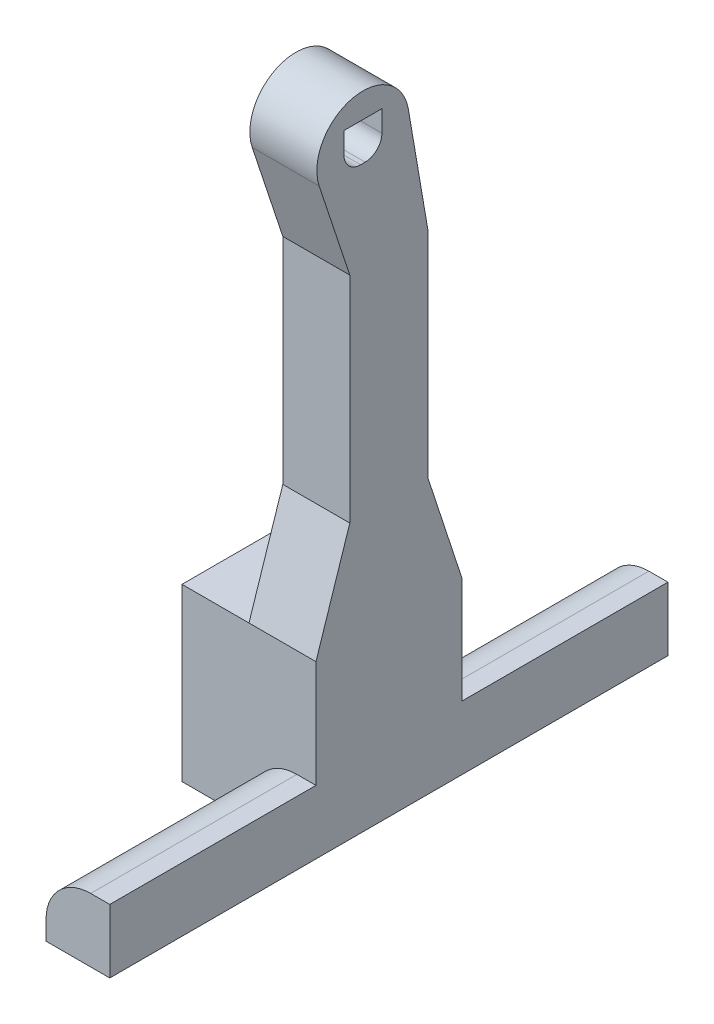
from build123d import *

# Parameters (mm, degrees)
SKETCH1_W                = 3.530112864
SKETCH1_H                = 9.82
BOSS_EXTRUDE2_DEPTH      = 6
SKETCH1_4_W              = 6
SKETCH1_4_H              = 9.82
SKETCH1_4_W_2            = 3.530112864
BOSS_EXTRUDE3_DEPTH      = 6
BOSS_EXTRUDE4_DEPTH      = 18.469887
BOSS_EXTRUDE4_DEPTH_BACK = 31.530113


with BuildPart() as part:
    # Sketch1 → Boss-Extrude2 (new body)
    with BuildSketch(Plane(origin=(0, 0, 0), x_dir=(0, 0, -1), z_dir=(1, 0, 0))):
        with Locations((4.765056432, 4.91)):
            Rectangle(SKETCH1_W, SKETCH1_H)
        with Locations((-4.765056432, 4.91)):
            Rectangle(SKETCH1_W, SKETCH1_H)
        Polygon((6.530112864, 9.82), (6.530112864, 15.3052734), (-6.530112864, 15.3052734), (-6.530112864, 9.82), (-3, 9.82), (3, 9.82), align=None)
    extrude(amount=-BOSS_EXTRUDE2_DEPTH)

    # Sketch1<4> → Boss-Extrude3 (add)
    # profile 1 of 6: a face of its own
    with BuildSketch(Plane(origin=(0, 0, 0), x_dir=(0, 0, -1), z_dir=(1, 0, 0))):
        with Locations((0, 4.91)):
            Rectangle(SKETCH1_4_W, SKETCH1_4_H)
    # profile 2 of 6: a face of its own
    with BuildSketch(Plane(origin=(0, 0, 0), x_dir=(0, 0, -1), z_dir=(1, 0, 0))):
        Polygon((-6.530112864, 9.82), (-3, 9.82), (3, 9.82), (6.530112864, 9.82), (6.530112864, 15.3052734), (-6.530112864, 15.3052734), align=None)
    # profile 3 of 6: a face of its own
    with BuildSketch(Plane(origin=(0, 0, 0), x_dir=(0, 0, -1), z_dir=(1, 0, 0))):
        with Locations((-4.765056432, 4.91)):
            Rectangle(SKETCH1_4_W_2, SKETCH1_4_H)
    # profile 4 of 6: a face of its own
    with BuildSketch(Plane(origin=(0, 0, 0), x_dir=(0, 0, -1), z_dir=(1, 0, 0))):
        with Locations((4.765056432, 4.91)):
            Rectangle(SKETCH1_4_W_2, SKETCH1_4_H)
    # profile 5 of 6: a face of its own
    with BuildSketch(Plane(origin=(0, 0, 0), x_dir=(0, 0, -1), z_dir=(1, 0, 0))):
        with BuildLine():
            Line((-3.498344074, 24.541666174), (-6.530112864, 15.3052734))
            Line((-6.530112864, 15.3052734), (6.530112864, 15.3052734))
            Line((6.530112864, 15.3052734), (3.498344074, 24.541666174))
            Line((3.498344074, 24.541666174), (3.498344074, 43.778718631))
            Line((3.498344074, 43.778718631), (1.742466173, 54.048264378))
            ThreePointArc((1.742466173, 54.048264378), (-3.323802498, 57.355930134), (-6.240866628, 52.055131338))
            Line((-6.240866628, 52.055131338), (-3.498344074, 43.778718631))
            Line((-3.498344074, 43.778718631), (-3.498344074, 24.541666174))
        make_face()
        with BuildLine():
            Line((-4.024402568, 55.252914737), (-0.624402568, 55.252914737))
            Line((-0.624402568, 55.252914737), (-0.624402568, 53.352914737))
            ThreePointArc((-0.624402568, 53.352914737), (-1.063742396, 52.292254566), (-2.124402568, 51.852914737))
            Line((-2.124402568, 51.852914737), (-2.524402568, 51.852914737))
            ThreePointArc((-2.524402568, 51.852914737), (-3.58506274, 52.292254566), (-4.024402568, 53.352914737))
            Line((-4.024402568, 53.352914737), (-4.024402568, 55.252914737))
        make_face(mode=Mode.SUBTRACT)
    # profile 6 of 6: a face of its own
    with BuildSketch(Plane(origin=(0, 0, 0), x_dir=(0, 0, -1), z_dir=(1, 0, 0))):
        with BuildLine():
            ThreePointArc((-3.824402568, 53.352914737), (-3.443641384, 52.433675922), (-2.524402568, 52.052914737))
            Line((-2.524402568, 52.052914737), (-2.124402568, 52.052914737))
            ThreePointArc((-2.124402568, 52.052914737), (-1.205163753, 52.433675922), (-0.824402568, 53.352914737))
            Line((-0.824402568, 53.352914737), (-0.824402568, 55.052914737))
            Line((-0.824402568, 55.052914737), (-3.824402568, 55.052914737))
            Line((-3.824402568, 55.052914737), (-3.824402568, 53.352914737))
        make_face()
    extrude(amount=BOSS_EXTRUDE3_DEPTH)


with BuildPart() as boss_extrude3_kept_piece:
    # of the separate pieces the step leaves, the one the design keeps (boss_extrude3_pieces_kept)
    add(part.part.solids().sort_by_distance((6, 0, -6.530112864))[0])

    # Sketch4 → Boss-Extrude4 (add, two sides: drawn at the far end of the back side and taken through both)
    with BuildSketch(Plane.XY.offset(6.530112864).offset(-BOSS_EXTRUDE4_DEPTH_BACK)):
        with BuildLine():
            Line((6, 0), (0.292808536, 0))
            Line((0.292808536, 0), (0.292808536, 1.707191464))
            ThreePointArc((0.292808536, 1.707191464), (1.464381411, 4.535618589), (4.292808536, 5.707191464))
            Line((4.292808536, 5.707191464), (6, 5.707191464))
            Line((6, 5.707191464), (6, 0))
        make_face()
    extrude(amount=BOSS_EXTRUDE4_DEPTH + BOSS_EXTRUDE4_DEPTH_BACK)


solid = boss_extrude3_kept_piece.part
